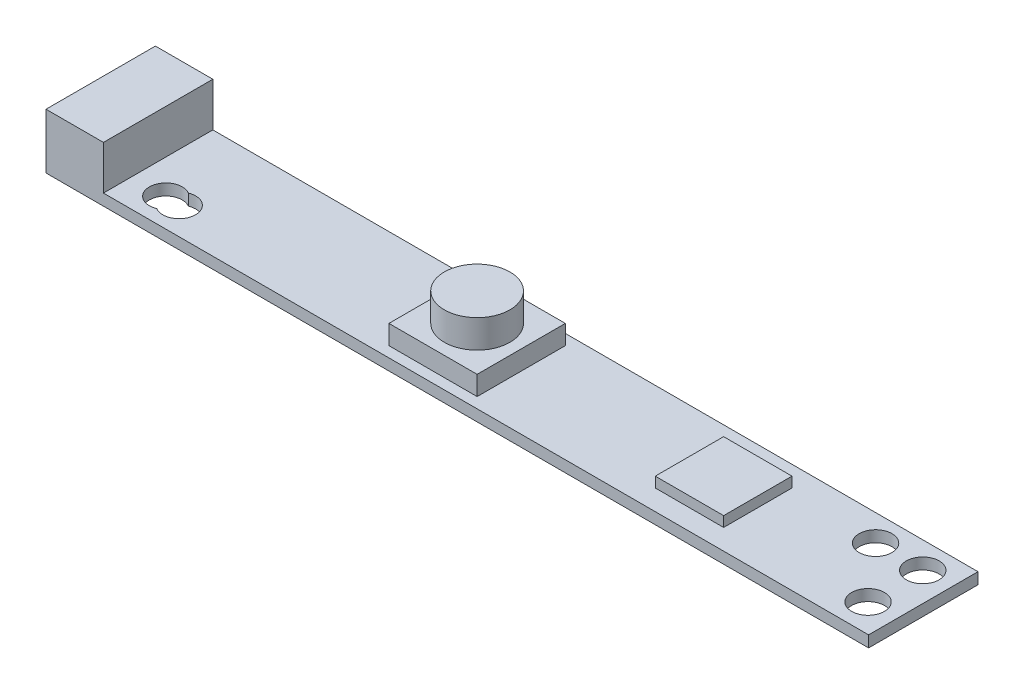
from build123d import *

# Parameters (mm, degrees)
SKETCH1_W            = 60.15
SKETCH1_H            = 8
BOSS_EXTRUDE1_DEPTH  = 0.83
SKETCH2_W            = 6.45
SKETCH2_H            = 6.45
SKETCH2_R            = 2.4
BOSS_EXTRUDE2_DEPTH  = 1.41
SKETCH2_3_R          = 2.4
BOSS_EXTRUDE3_DEPTH  = 3.47
SKETCH3_W            = 4.2
SKETCH3_H            = 8
BOSS_EXTRUDE4_DEPTH  = 3.21
M2_CLEARANCE_HOLE1_D = 2.4
SKETCH6_W            = 5
SKETCH6_H            = 5
BOSS_EXTRUDE5_DEPTH  = 0.75


with BuildPart() as part:
    # Sketch1 → Boss-Extrude1 (new body)
    with BuildSketch(Plane(origin=(0, 0, 0), x_dir=(1, 0, 0), z_dir=(0, 1, 0))):
        Rectangle(SKETCH1_W, SKETCH1_H)
    extrude(amount=BOSS_EXTRUDE1_DEPTH)

    # Sketch2 → Boss-Extrude2 (add)
    # profile 1 of 2: a face of its own
    with BuildSketch(Plane(origin=(0, 0.83, 0), x_dir=(1, 0, 0), z_dir=(0, 1, 0))):
        with Locations((-2.55, 0)):
            Rectangle(SKETCH2_W, SKETCH2_H)
        with Locations((-2.55, 0)):
            Circle(SKETCH2_R, mode=Mode.SUBTRACT)
    # profile 2 of 2: a face of its own
    with BuildSketch(Plane(origin=(0, 0.83, 0), x_dir=(1, 0, 0), z_dir=(0, 1, 0))):
        with Locations((-2.55, 0)):
            Circle(SKETCH2_R)
    extrude(amount=BOSS_EXTRUDE2_DEPTH)

    # Sketch2<3> → Boss-Extrude3 (add)
    with BuildSketch(Plane(origin=(0, 0.83, 0), x_dir=(1, 0, 0), z_dir=(0, 1, 0))):
        with Locations(Location((-2.55, 0, 0), (0, 0, 90))):
            Circle(SKETCH2_3_R)
    extrude(amount=BOSS_EXTRUDE3_DEPTH)

    # Sketch3 → Boss-Extrude4 (add)
    with BuildSketch(Plane(origin=(0, 0.83, 0), x_dir=(1, 0, 0), z_dir=(0, 1, 0))):
        with Locations((-27.975, 0)):
            Rectangle(SKETCH3_W, SKETCH3_H)
    extrude(amount=BOSS_EXTRUDE4_DEPTH)

    # M2 Clearance Hole1 (through all)
    with Locations(Plane(origin=(0, 0.83, 0), x_dir=(1, 0, 0), z_dir=(0, 1, 0))):
        with Locations((24.52, 2.065), (27.97, 2.065), (27.97, -1.935), (-23.39, -1.925), (-22.33, -2.005)):
            Hole(M2_CLEARANCE_HOLE1_D / 2)

    # Sketch6 → Boss-Extrude5 (add)
    with BuildSketch(Plane(origin=(0, 0.83, 0), x_dir=(1, 0, 0), z_dir=(0, 1, 0))):
        with Locations((15.475, 0)):
            Rectangle(SKETCH6_W, SKETCH6_H)
    extrude(amount=BOSS_EXTRUDE5_DEPTH)


solid = part.part
